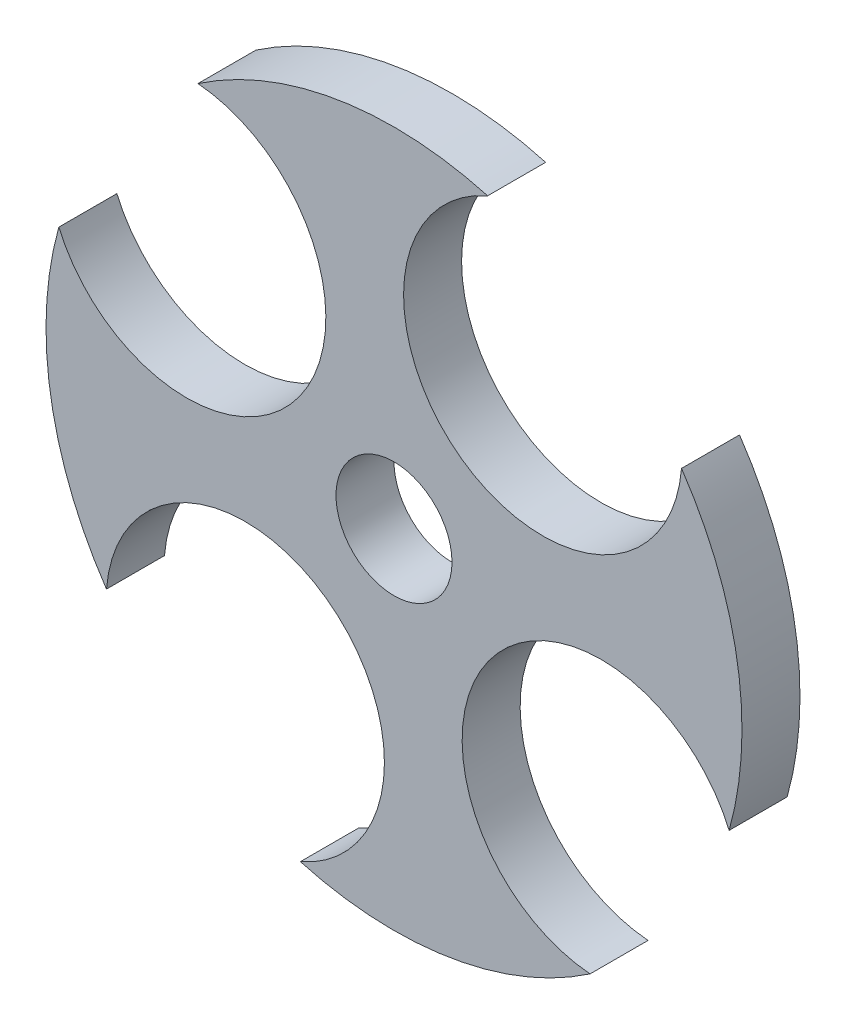
from build123d import *

# Parameters (mm, degrees)
SKETCH1_R           = 3.175
BOSS_EXTRUDE1_DEPTH = 3.175


with BuildPart() as part:
    # Sketch1 → Boss-Extrude1 (new body)
    with BuildSketch(Plane.XY):
        with BuildLine():
            ThreePointArc((-18.347125171, 5.126938458), (-18.797583349, -3.090851056), (-15.739512715, -10.731739817))
            ThreePointArc((-15.739512715, -10.731739817), (-3.702112305, -5.159153466), (-5.126938458, -18.347125171))
            ThreePointArc((-5.126938458, -18.347125171), (3.090851056, -18.797583349), (10.731739817, -15.739512715))
            ThreePointArc((10.731739817, -15.739512715), (5.159153466, -3.702112305), (18.347125171, -5.126938458))
            ThreePointArc((18.347125171, -5.126938458), (18.797583349, 3.090851056), (15.739512715, 10.731739817))
            ThreePointArc((15.739512715, 10.731739817), (3.702112305, 5.159153466), (5.126938458, 18.347125171))
            ThreePointArc((5.126938458, 18.347125171), (-3.090851056, 18.797583349), (-10.731739817, 15.739512715))
            ThreePointArc((-10.731739817, 15.739512715), (-5.159153466, 3.702112305), (-18.347125171, 5.126938458))
        make_face()
        Circle(SKETCH1_R, mode=Mode.SUBTRACT)
    extrude(amount=BOSS_EXTRUDE1_DEPTH)


solid = part.part
